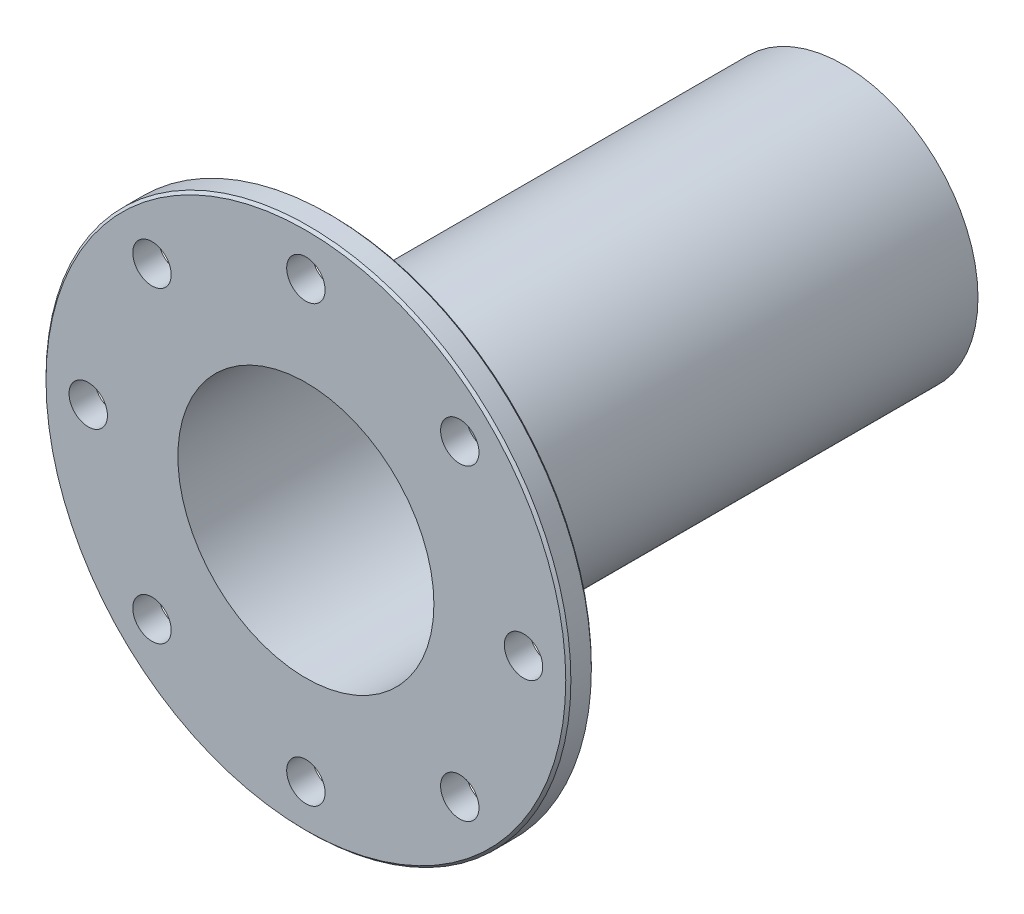
from build123d import *

# Parameters (mm, degrees)
SKETCH2_R          = 15
CUT_EXTRUDE1_DEPTH = 20
CHAMFER1_SIZE      = 2


with BuildPart() as part:
    # Sketch1 → Revolve1 (revolve)
    with BuildSketch(Plane(origin=(0, 0, 0), x_dir=(0, 0, -1), z_dir=(1, 0, 0)), mode=Mode.PRIVATE) as revolve1_sk:
        Polygon((0, 100), (0, 205), (20, 205), (20, 105), (420, 105), (420, 100), align=None)
    revolve(revolve1_sk.sketch.rotate(Axis((0, 0, 0), (0, 0, -1)), 90), axis=Axis((0, 0, 0), (0, 0, -1)))

    # Sketch2 → Cut-Extrude1 (cut)
    with BuildSketch(Plane.XY):
        with Locations((0, 170)):
            Circle(SKETCH2_R)
        with Locations((120.208152802, 120.208152802)):
            Circle(SKETCH2_R)
        with Locations((170, 0)):
            Circle(SKETCH2_R)
        with Locations((120.208152802, -120.208152802)):
            Circle(SKETCH2_R)
        with Locations((0, -170)):
            Circle(SKETCH2_R)
        with Locations((-120.208152802, -120.208152802)):
            Circle(SKETCH2_R)
        with Locations((-170, 0)):
            Circle(SKETCH2_R)
        with Locations((-120.208152802, 120.208152802)):
            Circle(SKETCH2_R)
    extrude(amount=-CUT_EXTRUDE1_DEPTH, mode=Mode.SUBTRACT)

    # Chamfer1
    chamfer1_edges = [part.edges().sort_by_distance(p)[0] for p in [
        (-205, 0, -20),
        (-205, 0, 0),
    ]]
    chamfer(chamfer1_edges, length=CHAMFER1_SIZE)


solid = part.part
